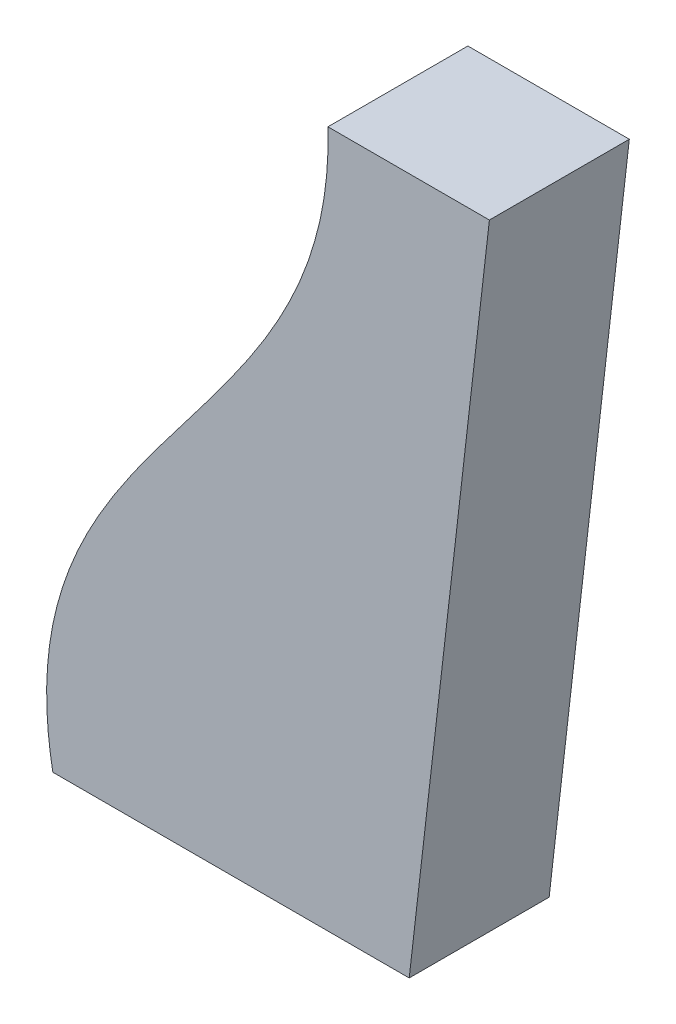
from build123d import *

# Parameters (mm, degrees)
BOSS_EXTRUDE1_DEPTH = 6


with BuildPart() as part:
    # Sketch1 → Boss-Extrude1 (new body)
    with BuildSketch(Plane.XY):
        with BuildLine():
            Line((11.795360814, 29.864255565), (18.717875998, 29.864255565))
            Line((18.717875998, 29.864255565), (15.280029016, 0))
            Line((15.280029016, 0), (0, 0))
            add(Edge.make_bspline(
                [(0, 0), (-2.395179582, 12.813962905), (12.1785616, 17.611160307), (11.795360814, 29.864255565)],
                knots=[0, 0, 0, 0, 1, 1, 1, 1], degree=3))
        make_face()
    extrude(amount=BOSS_EXTRUDE1_DEPTH)


solid = part.part
